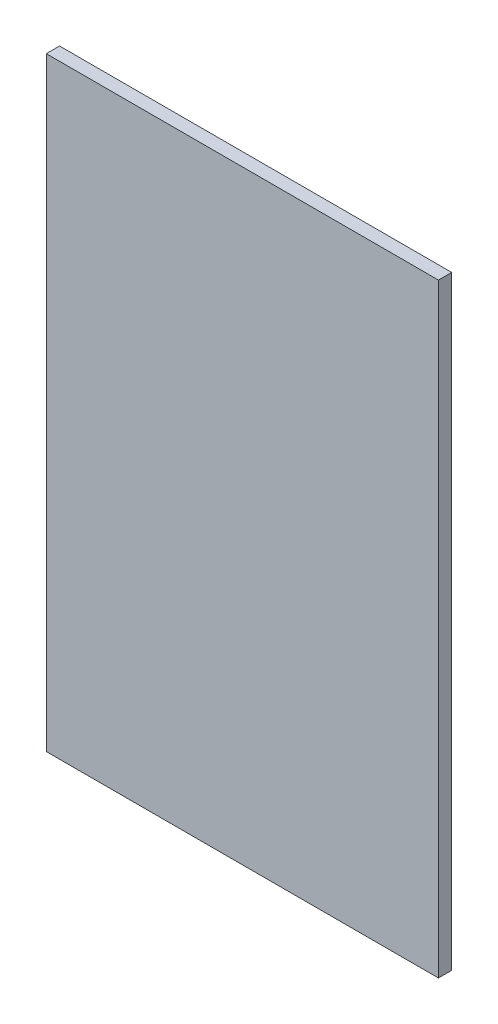
from build123d import *

# Parameters (mm, degrees)
SKETCH1_W           = 532
SKETCH1_H           = 820
BOSS_EXTRUDE1_DEPTH = 18


with BuildPart() as part:
    # Sketch1 → Boss-Extrude1 (new body)
    with BuildSketch(Plane.XY):
        Rectangle(SKETCH1_W, SKETCH1_H)
    extrude(amount=BOSS_EXTRUDE1_DEPTH)


solid = part.part
